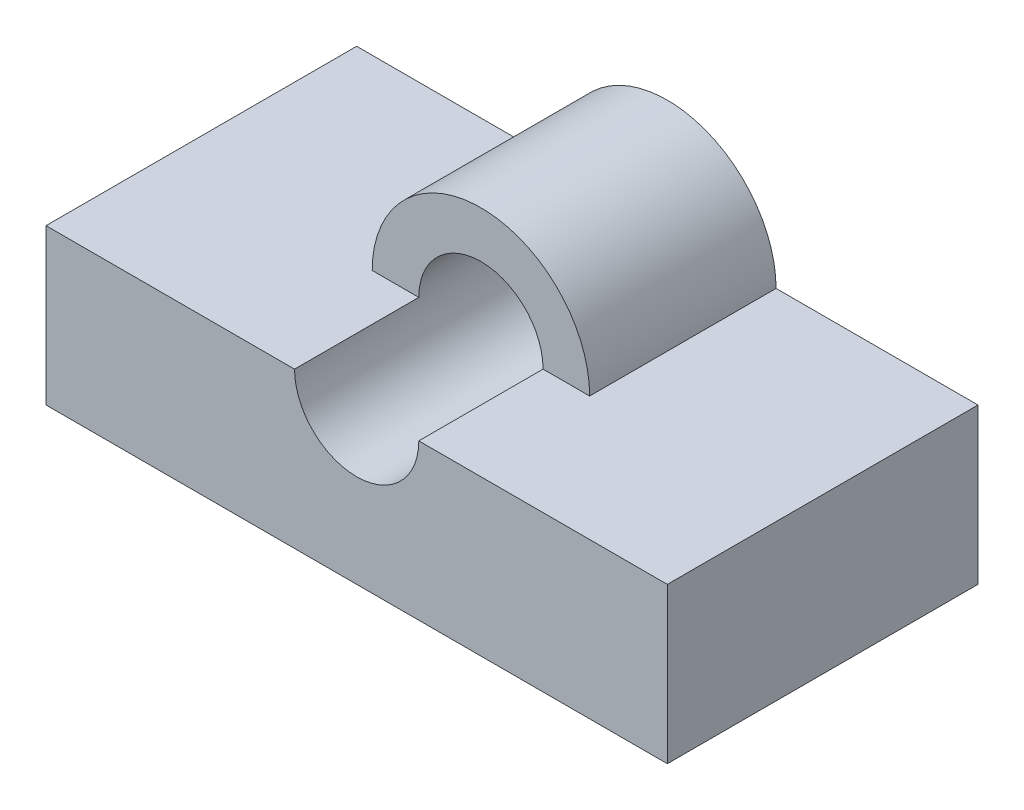
from build123d import *
from build123d.topology import SkipClean

# Parameters (mm, degrees)
BOSS_EXTRUDE1_DEPTH = 50
SKETCH1_3_R         = 17.5
SKETCH1_3_R_2       = 10
BOSS_EXTRUDE2_DEPTH = 30


with BuildPart() as part:
    # Sketch1 → Boss-Extrude1 (new body)
    with BuildSketch(Plane.XY):
        with BuildLine():
            Line((0, 25), (0, 0))
            Line((0, 0), (100, 0))
            Line((100, 0), (100, 25))
            Line((100, 25), (60, 25))
            ThreePointArc((60, 25), (50, 15), (40, 25))
            Line((40, 25), (0, 25))
        make_face()
    extrude(amount=BOSS_EXTRUDE1_DEPTH)

    # Sketch1<3> → Boss-Extrude2 (add)
    with SkipClean():  # the faces are left unmerged after this step: merging them gives an invalid solid
        with BuildSketch(Plane.XY):
            with Locations((50, 25)):
                Circle(SKETCH1_3_R)
            with Locations((50, 25)):
                Circle(SKETCH1_3_R_2, mode=Mode.SUBTRACT)
        extrude(amount=BOSS_EXTRUDE2_DEPTH)


solid = part.part
